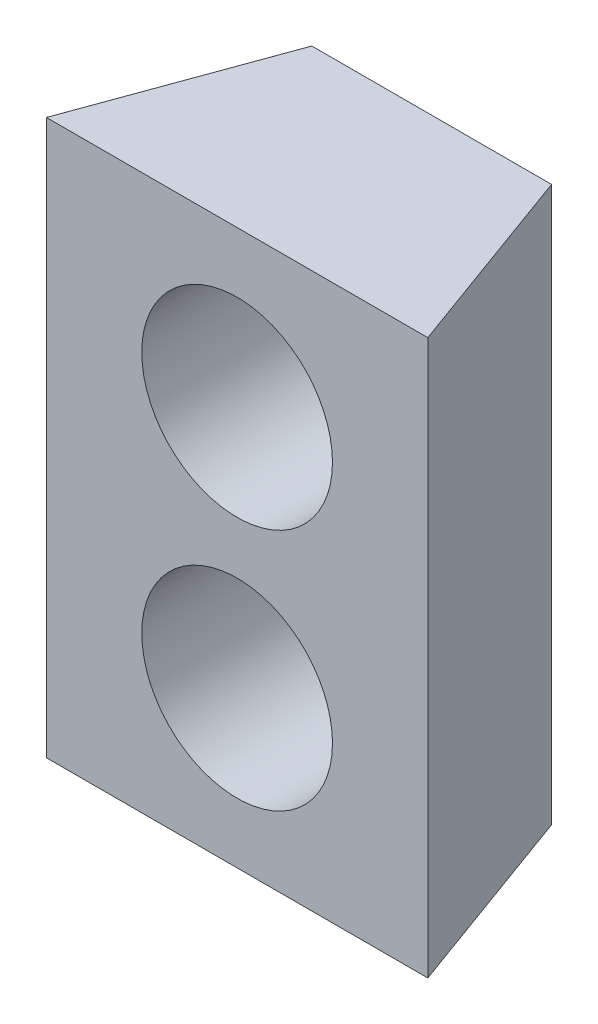
from build123d import *

# Parameters (mm, degrees)
SKETCH1_W           = 12.446
SKETCH1_H           = 18.0975
SKETCH1_R           = 3.1115
BOSS_EXTRUDE1_DEPTH = 6.35
CUT_EXTRUDE1_DEPTH  = 23.863615686
SKETCH3_R           = 3.1115
SKETCH3_R_2         = 2.8575
BOSS_EXTRUDE2_DEPTH = 1.27


with BuildPart() as part:
    # sketch1 → Boss-Extrude1 (new body)
    with BuildSketch(Plane.XY):
        with Locations((6.223, 9.04875)):
            Rectangle(SKETCH1_W, SKETCH1_H)
        with Locations((6.223, 5.08)):
            Circle(SKETCH1_R, mode=Mode.SUBTRACT)
        with Locations((6.223, 13.0175)):
            Circle(SKETCH1_R, mode=Mode.SUBTRACT)
    extrude(amount=BOSS_EXTRUDE1_DEPTH)

    # Sketch2 → Cut-Extrude1 (cut, through all)
    with BuildSketch(Plane(origin=(0, 18.0975, 0), x_dir=(1, 0, 0), z_dir=(0, 1, 0))):
        Polygon((0, -6.35), (0, 0), (2.311210988, 0), align=None)
        Polygon((12.446, -6.35), (12.446, 0), (10.134789012, 0), align=None)
    extrude(amount=-CUT_EXTRUDE1_DEPTH, mode=Mode.SUBTRACT)

    # Sketch3 → Boss-Extrude2 (add)
    # profile 1 of 2: a face of its own
    with BuildSketch(Plane(origin=(0, 0, 0), x_dir=(-1, 0, 0), z_dir=(0, 0, -1))):
        with Locations((-6.223, 5.08)):
            Circle(SKETCH3_R)
        with Locations((-6.223, 5.08)):
            Circle(SKETCH3_R_2, mode=Mode.SUBTRACT)
    # profile 2 of 2: a face of its own
    with BuildSketch(Plane(origin=(0, 0, 0), x_dir=(-1, 0, 0), z_dir=(0, 0, -1))):
        with Locations((-6.223, 13.0175)):
            Circle(SKETCH3_R)
        with Locations((-6.223, 13.0175)):
            Circle(SKETCH3_R_2, mode=Mode.SUBTRACT)
    extrude(amount=-BOSS_EXTRUDE2_DEPTH)


solid = part.part
